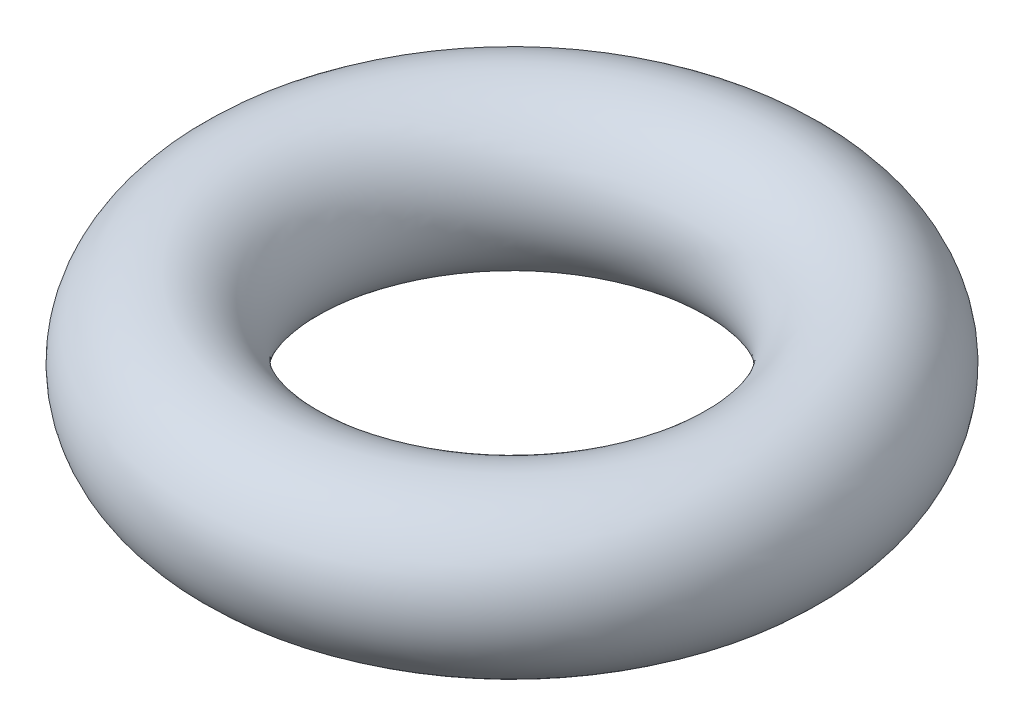
from build123d import *

# Parameters (mm, degrees)
SWEEP1_PROFILE_R = 0.95


with BuildPart() as part:
    # Sweep1: sweep along a path in Sketch1
    with BuildLine(Plane(origin=(0, 0, 0), x_dir=(1, 0, 0), z_dir=(0, 1, 0))) as sweep1_path:
        CenterArc((0, 0), 3, 0, 360)
    # Sweep1 profile (on start of the path) → Sweep1 (sweep)
    with BuildSketch(Plane(origin=(3, 0, 0), x_dir=(-1, 0, 0), z_dir=(0, 0, -1))):
        Circle(SWEEP1_PROFILE_R)
    sweep(path=sweep1_path.line)


solid = part.part
